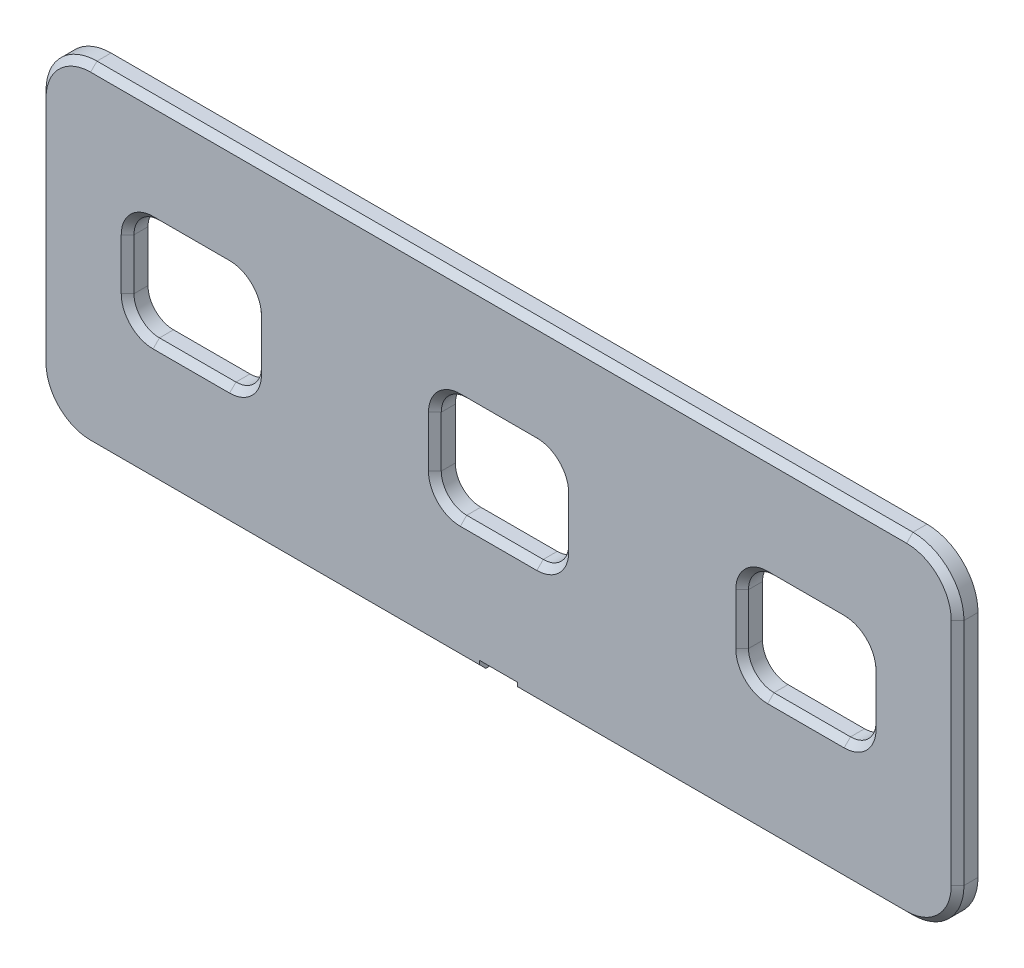
from build123d import *

# Parameters (mm, degrees)
BOSS_EXTRUDE1_START = 78.4
BOSS_EXTRUDE1_DEPTH = 1.6
CHAMFER1_SIZE       = 0.5
BOSS_EXTRUDE2_START = 78
BOSS_EXTRUDE2_DEPTH = 3
CHAMFER2_SIZE       = 0.5
BOSS_EXTRUDE3_START = 78
BOSS_EXTRUDE3_DEPTH = 3
CHAMFER3_SIZE       = 0.5
BOSS_EXTRUDE4_START = 78
BOSS_EXTRUDE4_DEPTH = 3
CHAMFER4_SIZE       = 0.5
BOSS_EXTRUDE5_START = 79.2
SKETCH5_W           = 3
SKETCH5_H           = 0.9
BOSS_EXTRUDE5_DEPTH = 0.9
BOSS_EXTRUDE6_START = -32
BOSS_EXTRUDE6_DEPTH = 4
BOSS_EXTRUDE7_START = 28
BOSS_EXTRUDE7_DEPTH = 4


with BuildPart() as part:
    # Sketch1 → Boss-Extrude1 (new body)
    with BuildSketch(Plane.XY.offset(BOSS_EXTRUDE1_START)):
        with BuildLine():
            Line((-32, 8.6), (32, 8.6))
            ThreePointArc((32, 8.6), (34.828427125, 9.771572875), (36, 12.6))
            Line((36, 12.6), (36, 30.6))
            ThreePointArc((36, 30.6), (34.828427125, 33.428427125), (32, 34.6))
            Line((32, 34.6), (-32, 34.6))
            ThreePointArc((-32, 34.6), (-34.828427125, 33.428427125), (-36, 30.6))
            Line((-36, 30.6), (-36, 12.6))
            ThreePointArc((-36, 12.6), (-34.828427125, 9.771572875), (-32, 8.6))
        make_face()
    extrude(amount=BOSS_EXTRUDE1_DEPTH)

    # Chamfer1
    chamfer1_edges = [part.edges().sort_by_distance(p)[0] for p in [
        (0, 8.6, 80),
        (34.828427125, 9.771572875, 80),
        (-34.828427125, 9.771572875, 80),
        (36, 21.6, 80),
        (-36, 21.6, 80),
        (34.828427125, 33.428427125, 80),
        (-34.828427125, 33.428427125, 80),
        (0, 34.6, 80),
    ]]
    chamfer(chamfer1_edges, length=CHAMFER1_SIZE)


with BuildPart() as body_2:
    # Sketch2 → Boss-Extrude2 (new body)
    with BuildSketch(Plane.XY.offset(BOSS_EXTRUDE2_START)):
        with BuildLine():
            Line((-3, 18.25), (3, 18.25))
            ThreePointArc((3, 18.25), (4.414213562, 18.835786438), (5, 20.25))
            Line((5, 20.25), (5, 24.25))
            ThreePointArc((5, 24.25), (4.414213562, 25.664213562), (3, 26.25))
            Line((3, 26.25), (-3, 26.25))
            ThreePointArc((-3, 26.25), (-4.414213562, 25.664213562), (-5, 24.25))
            Line((-5, 24.25), (-5, 20.25))
            ThreePointArc((-5, 20.25), (-4.414213562, 18.835786438), (-3, 18.25))
        make_face()
    extrude(amount=BOSS_EXTRUDE2_DEPTH)


with BuildPart() as part_1:
    add(part.part)

    # Combine1: cut body 2
    add(body_2.part, mode=Mode.SUBTRACT)

    # Chamfer2
    chamfer2_edges = [part_1.edges().sort_by_distance(p)[0] for p in [
        (0, 18.25, 80),
        (-4.414213562, 18.835786438, 80),
        (4.414213562, 18.835786438, 80),
        (-5, 22.25, 80),
        (5, 22.25, 80),
        (-4.414213562, 25.664213562, 80),
        (4.414213562, 25.664213562, 80),
        (0, 26.25, 80),
    ]]
    chamfer(chamfer2_edges, length=CHAMFER2_SIZE)


with BuildPart() as body_2_2:
    # Sketch3 → Boss-Extrude3 (new body)
    with BuildSketch(Plane.XY.offset(BOSS_EXTRUDE3_START)):
        with BuildLine():
            Line((21.1, 18.25), (27.1, 18.25))
            ThreePointArc((27.1, 18.25), (28.514213562, 18.835786438), (29.1, 20.25))
            Line((29.1, 20.25), (29.1, 24.25))
            ThreePointArc((29.1, 24.25), (28.514213562, 25.664213562), (27.1, 26.25))
            Line((27.1, 26.25), (21.1, 26.25))
            ThreePointArc((21.1, 26.25), (19.685786438, 25.664213562), (19.1, 24.25))
            Line((19.1, 24.25), (19.1, 20.25))
            ThreePointArc((19.1, 20.25), (19.685786438, 18.835786438), (21.1, 18.25))
        make_face()
    extrude(amount=BOSS_EXTRUDE3_DEPTH)


with BuildPart() as part_2:
    add(part_1.part)

    # Combine2: cut body 2 2
    add(body_2_2.part, mode=Mode.SUBTRACT)

    # Chamfer3
    chamfer3_edges = [part_2.edges().sort_by_distance(p)[0] for p in [
        (24.1, 18.25, 80),
        (19.685786438, 18.835786438, 80),
        (28.514213562, 18.835786438, 80),
        (19.1, 22.25, 80),
        (29.1, 22.25, 80),
        (19.685786438, 25.664213562, 80),
        (28.514213562, 25.664213562, 80),
        (24.1, 26.25, 80),
    ]]
    chamfer(chamfer3_edges, length=CHAMFER3_SIZE)


with BuildPart() as body_2_3:
    # Sketch4 → Boss-Extrude4 (new body)
    with BuildSketch(Plane.XY.offset(BOSS_EXTRUDE4_START)):
        with BuildLine():
            Line((-27.1, 18.25), (-21.1, 18.25))
            ThreePointArc((-21.1, 18.25), (-19.685786438, 18.835786438), (-19.1, 20.25))
            Line((-19.1, 20.25), (-19.1, 24.25))
            ThreePointArc((-19.1, 24.25), (-19.685786438, 25.664213562), (-21.1, 26.25))
            Line((-21.1, 26.25), (-27.1, 26.25))
            ThreePointArc((-27.1, 26.25), (-28.514213562, 25.664213562), (-29.1, 24.25))
            Line((-29.1, 24.25), (-29.1, 20.25))
            ThreePointArc((-29.1, 20.25), (-28.514213562, 18.835786438), (-27.1, 18.25))
        make_face()
    extrude(amount=BOSS_EXTRUDE4_DEPTH)


with BuildPart() as part_3:
    add(part_2.part)

    # Combine3: cut body 2 3
    add(body_2_3.part, mode=Mode.SUBTRACT)

    # Chamfer4
    chamfer4_edges = [part_3.edges().sort_by_distance(p)[0] for p in [
        (-24.1, 18.25, 80),
        (-28.514213562, 18.835786438, 80),
        (-19.685786438, 18.835786438, 80),
        (-29.1, 22.25, 80),
        (-19.1, 22.25, 80),
        (-28.514213562, 25.664213562, 80),
        (-19.685786438, 25.664213562, 80),
        (-24.1, 26.25, 80),
    ]]
    chamfer(chamfer4_edges, length=CHAMFER4_SIZE)


with BuildPart() as body_2_4:
    # Sketch5 → Boss-Extrude5 (new body)
    with BuildSketch(Plane.XY.offset(BOSS_EXTRUDE5_START)):
        with Locations((0, 8.95)):
            Rectangle(SKETCH5_W, SKETCH5_H)
    extrude(amount=BOSS_EXTRUDE5_DEPTH)


with BuildPart() as part_4:
    add(part_3.part)

    # Combine4: cut body 2 4
    add(body_2_4.part, mode=Mode.SUBTRACT)

    # Sketch6 → Boss-Extrude6 (add)
    with BuildSketch(Plane(origin=(0, 0, 0), x_dir=(0, 0, -1), z_dir=(1, 0, 0)).offset(BOSS_EXTRUDE6_START)):
        Polygon((-78.41, 12), (-74.6, 12), (-74.6, 12.8), (-74.9, 13.1), (-75.2, 13.1), (-75.2, 12.8), (-78.41, 12.8), align=None)
    extrude(amount=BOSS_EXTRUDE6_DEPTH)

    # Sketch7 → Boss-Extrude7 (add)
    with BuildSketch(Plane(origin=(0, 0, 0), x_dir=(0, 0, -1), z_dir=(1, 0, 0)).offset(BOSS_EXTRUDE7_START)):
        Polygon((-78.41, 12), (-74.6, 12), (-74.6, 12.8), (-74.9, 13.1), (-75.2, 13.1), (-75.2, 12.8), (-78.41, 12.8), align=None)
    extrude(amount=BOSS_EXTRUDE7_DEPTH)


solid = part_4.part
